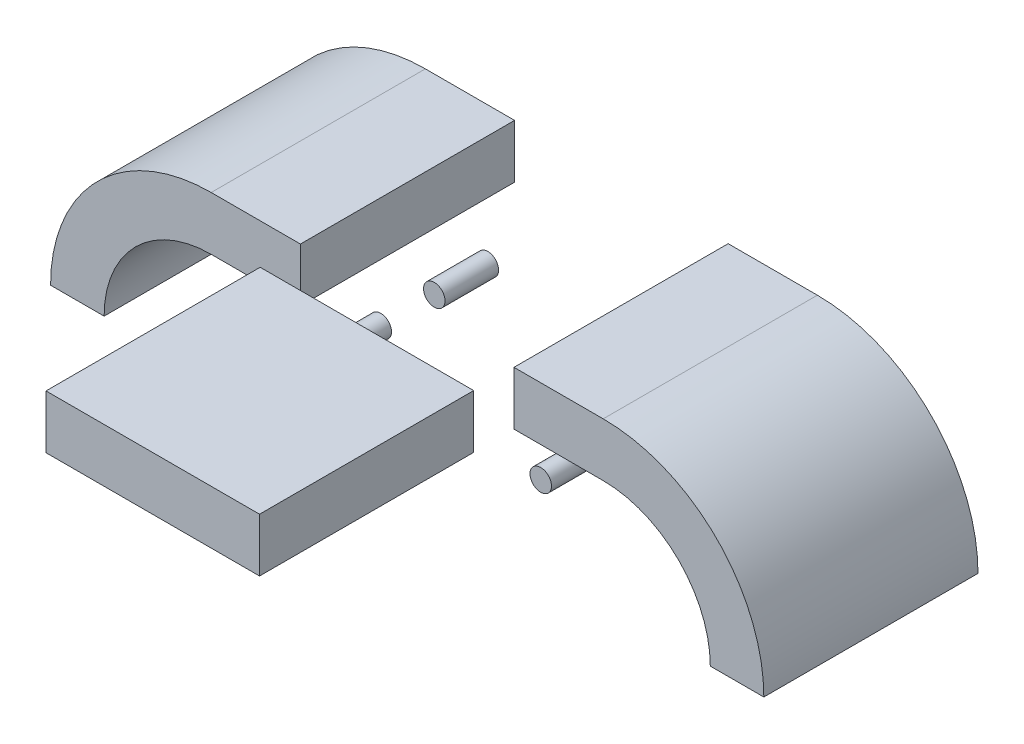
from build123d import *

# Parameters (mm, degrees)
SKETCH_2_W      = 20
SKETCH_2_H      = 12
EXTRUDE_2_DEPTH = 48
EXTRUDE_4_DEPTH = 48
SKETCH_13_W     = 47.859649122
SKETCH_13_H     = 48
EXTRUDE_5_DEPTH = 12
EXTRUDE_START   = 6
SKETCH_15_R     = 2.409896086
EXTRUDE_6_DEPTH = 12


with BuildPart() as part:
    # 草图2 → 凸台-拉伸2 (new body)
    with BuildSketch(Plane.XY):
        with Locations((33.929824561, 6)):
            Rectangle(SKETCH_2_W, SKETCH_2_H)
    extrude(amount=EXTRUDE_2_DEPTH)

    # 草图9 → 凸台-拉伸4 (add)
    with BuildSketch(Plane.XY.offset(48)):
        with BuildLine():
            Line((67.929824561, -24), (79.929824561, -24))
            ThreePointArc((79.929824561, -24), (69.385668684, 1.455844123), (43.929824561, 12))
            Line((43.929824561, 12), (43.929824561, 0))
            ThreePointArc((43.929824561, 0), (60.90038731, -7.029437252), (67.929824561, -24))
        make_face()
    extrude(amount=-EXTRUDE_4_DEPTH)


with BuildPart() as body_2:
    # 镜向10: mirrored copy
    add(part.part.mirror(Plane(origin=(0, 0, 0), x_dir=(0, 0, 1), z_dir=(1, 0, 0))))


with BuildPart() as body_3:
    # 草图13 → 凸台-拉伸5 (new body)
    with BuildSketch(Plane(origin=(0, 0, 0), x_dir=(1, 0, 0), z_dir=(0, 1, 0))):
        with Locations((0, -81.024626709)):
            Rectangle(SKETCH_13_W, SKETCH_13_H)
    extrude(amount=EXTRUDE_5_DEPTH)


with BuildPart() as body_4:
    # 草图15 → 凸台-拉伸6 (new body)
    with BuildSketch(Plane.XY.offset(EXTRUDE_START)):
        with Locations((-23.929824561, -12.850945387)):
            Circle(SKETCH_15_R)
    extrude(amount=EXTRUDE_6_DEPTH)


with BuildPart() as body_5:
    # 镜向11: mirrored copy
    add(body_4.part.mirror(Plane.XY.offset(24)))


with BuildPart() as body_6:
    # 镜向13: mirrored copy
    add(body_4.part.mirror(Plane(origin=(0, 0, 0), x_dir=(0, 0, 1), z_dir=(1, 0, 0))))


with BuildPart() as body_7:
    # Mirror 13 2: mirrored copy
    add(body_5.part.mirror(Plane(origin=(0, 0, 0), x_dir=(0, 0, 1), z_dir=(1, 0, 0))))


solid = Compound([part.part, body_2.part, body_3.part, body_4.part, body_5.part, body_6.part, body_7.part])
